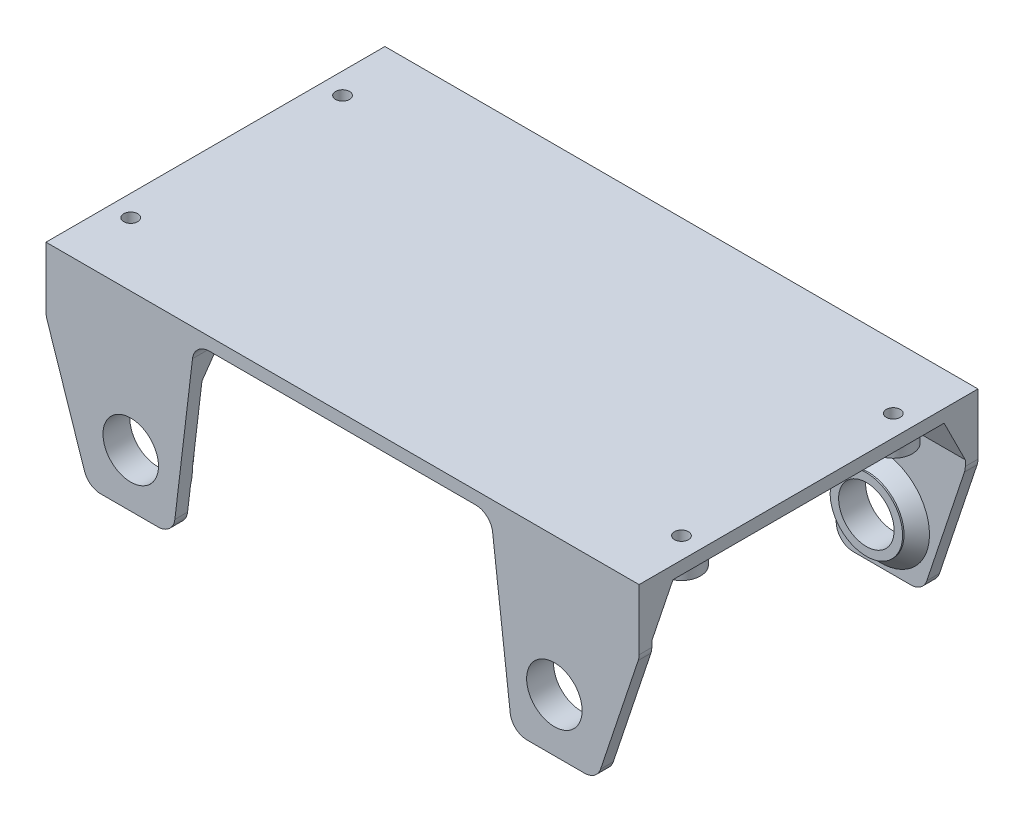
from build123d import *
from OCP.BRepFilletAPI import BRepFilletAPI_MakeChamfer

# Parameters (mm, degrees)
CROQUIS1_W                 = 140
CROQUIS1_H                 = 45
SALIENTE_EXTRUIR1_DEPTH    = 40
CORTAR_EXTRUIR1_DEPTH      = 84.703345214
CORTAR_EXTRUIR1_DEPTH_BACK = 84.703345214
CROQUIS2_W                 = 74
CROQUIS2_H                 = 42
CROQUIS3_R                 = 6.55
CORTAR_EXTRUIR2_DEPTH      = 80
CROQUIS10_R                = 8.55
CROQUIS10_R_2              = 6.55
SALIENTE_EXTRUIR3_DEPTH    = 3.35
CORTAR_EXTRUIR3_REACH      = 92.907
CROQUIS4_R                 = 1.651
CROQUIS5_R                 = 4.5
CROQUIS5_R_2               = 3.5
SALIENTE_EXTRUIR2_DEPTH    = 3
CHAFL_N3_SIZE              = 3
CORTAR_EXTRUIR5_DEPTH      = 84.703345214
CORTAR_EXTRUIR5_DEPTH_BACK = 84.703345214
REDONDEO1_R                = 4
CHAFL_N1_SIZE              = 10
CHAFL_N1_SIZE2             = 5
CHAFL_N2_SIZE              = 5
CHAFL_N2_SIZE2             = 10


with BuildPart() as part:
    # Croquis1 → Saliente-Extruir1 (new, symmetric)
    with BuildSketch(Plane.XY):
        Rectangle(CROQUIS1_W, CROQUIS1_H)
    extrude(amount=SALIENTE_EXTRUIR1_DEPTH, both=True)

    # Croquis2 → Cortar-Extruir1 (cut, two sides: drawn at the far end of the back side and taken through both)
    with BuildSketch(Plane(origin=(0, 0, 0), x_dir=(0, 0, -1), z_dir=(1, 0, 0)).offset(-CORTAR_EXTRUIR1_DEPTH_BACK)):
        with Locations((0, -1.5)):
            Rectangle(CROQUIS2_W, CROQUIS2_H)
    extrude(amount=CORTAR_EXTRUIR1_DEPTH + CORTAR_EXTRUIR1_DEPTH_BACK, mode=Mode.SUBTRACT)

    # Croquis3 → Cortar-Extruir2 (cut)
    with BuildSketch(Plane.XY.offset(40)):
        with Locations((50, -10)):
            Circle(CROQUIS3_R)
        with Locations((-50, -10)):
            Circle(CROQUIS3_R)
    extrude(amount=-CORTAR_EXTRUIR2_DEPTH, mode=Mode.SUBTRACT)

    # Croquis10 → Saliente-Extruir3 (add)
    # profile 1 of 2: a face of its own
    with BuildSketch(Plane(origin=(0, 0, 37), x_dir=(-1, 0, 0), z_dir=(0, 0, -1))):
        with Locations(Location((-50, -10, 0), (0, 0, 270))):
            Circle(CROQUIS10_R)
        with Locations(Location((-50, -10, 0), (0, 0, 180))):
            Circle(CROQUIS10_R_2, mode=Mode.SUBTRACT)
    # profile 2 of 2: a face of its own
    with BuildSketch(Plane(origin=(0, 0, 37), x_dir=(-1, 0, 0), z_dir=(0, 0, -1))):
        with Locations(Location((50, -10, 0), (0, 0, 270))):
            Circle(CROQUIS10_R)
        with Locations(Location((50, -10, 0), (0, 0, 180))):
            Circle(CROQUIS10_R_2, mode=Mode.SUBTRACT)
    saliente_extruir3 = extrude(amount=SALIENTE_EXTRUIR3_DEPTH)

    # Simetría1: Saliente-Extruir3 across plane
    add(saliente_extruir3.mirror(Plane.XY))

    # Croquis4 → Cortar-Extruir3 (cut, up to next)
    with BuildSketch(Plane.XZ.offset(-19.5), mode=Mode.PRIVATE) as cortar_extruir3_sk1:
        with Locations(Location((-65, 25, 0), (0, 0, 270))):
            Circle(CROQUIS4_R)
    cortar_extruir3_tool1 = extrude(cortar_extruir3_sk1.sketch, amount=-CORTAR_EXTRUIR3_REACH, mode=Mode.PRIVATE) & part.part
    # Croquis4 → Cortar-Extruir3 (cut, up to next)
    with BuildSketch(Plane.XZ.offset(-19.5), mode=Mode.PRIVATE) as cortar_extruir3_sk2:
        with Locations(Location((-65, -25, 0), (0, 0, 270))):
            Circle(CROQUIS4_R)
    cortar_extruir3_tool2 = extrude(cortar_extruir3_sk2.sketch, amount=-CORTAR_EXTRUIR3_REACH, mode=Mode.PRIVATE) & part.part
    cortar_extruir3_1 = cortar_extruir3_tool1.solids().sort_by_distance((-65, 19.5, 25))[0]
    add(cortar_extruir3_1, mode=Mode.SUBTRACT)
    cortar_extruir3_2 = cortar_extruir3_tool2.solids().sort_by_distance((-65, 19.5, -25))[0]
    add(cortar_extruir3_2, mode=Mode.SUBTRACT)
    cortar_extruir3 = cortar_extruir3_1 + cortar_extruir3_2  # Cortar-Extruir3 as one shape, for the pattern or mirror that repeats it

    # Croquis5 → Saliente-Extruir2 (add)
    # profile 1 of 2: a face of its own
    with BuildSketch(Plane.XZ.offset(-19.5)):
        with Locations(Location((-65, 25, 0), (0, 0, 90))):
            Circle(CROQUIS5_R)
        with Locations(Location((-65, 25, 0), (0, 0, 270))):
            Circle(CROQUIS5_R_2, mode=Mode.SUBTRACT)
    # profile 2 of 2: a face of its own
    with BuildSketch(Plane.XZ.offset(-19.5)):
        with Locations(Location((-65, -25, 0), (0, 0, 90))):
            Circle(CROQUIS5_R)
        with Locations(Location((-65, -25, 0), (0, 0, 270))):
            Circle(CROQUIS5_R_2, mode=Mode.SUBTRACT)
    saliente_extruir2 = extrude(amount=SALIENTE_EXTRUIR2_DEPTH)

    # Simetría2: Cortar-Extruir3, Saliente-Extruir2 across plane
    add(cortar_extruir3.mirror(Plane(origin=(0, 0, 0), x_dir=(0, 0, 1), z_dir=(1, 0, 0))), mode=Mode.SUBTRACT)
    add(saliente_extruir2.mirror(Plane(origin=(0, 0, 0), x_dir=(0, 0, 1), z_dir=(1, 0, 0))))

    # Chaflán3
    chafl_n3_edges = [part.edges().sort_by_distance(p)[0] for p in [
        (50, -1.45, 37),
        (-50, -1.45, 37),
        (50, -1.45, -37),
        (-50, -1.45, -37),
    ]]
    chamfer(chafl_n3_edges, length=CHAFL_N3_SIZE)

    # Croquis9 → Cortar-Extruir5 (cut, two sides: drawn at the far end of the back side and taken through both)
    with BuildSketch(Plane.XY.offset(-CORTAR_EXTRUIR5_DEPTH_BACK)):
        Polygon((-40, -22.5), (-35, 19.5), (35, 19.5), (40, -22.5), align=None)
        Polygon((-70, 7.5), (-60, -22.5), (-70, -22.5), align=None)
        Polygon((70, 7.5), (60, -22.5), (70, -22.5), align=None)
    extrude(amount=CORTAR_EXTRUIR5_DEPTH + CORTAR_EXTRUIR5_DEPTH_BACK, mode=Mode.SUBTRACT)

    # Redondeo1
    redondeo1_edges = [part.edges().sort_by_distance(p)[0] for p in [
        (40, -22.5, 38.5),
        (40, -22.5, -38.5),
        (-35, 19.5, 38.5),
        (-35, 19.5, -38.5),
        (-40, -22.5, -38.5),
        (-40, -22.5, 38.5),
        (35, 19.5, -38.5),
        (35, 19.5, 38.5),
        (-70, 7.5, 38.5),
        (-70, 7.5, -38.5),
        (-60, -22.5, 38.5),
        (-60, -22.5, -38.5),
        (70, 7.5, 38.5),
        (70, 7.5, -38.5),
        (60, -22.5, 38.5),
        (60, -22.5, -38.5),
    ]]
    fillet(redondeo1_edges, radius=REDONDEO1_R)

    # Chaflán1: one chamfer whose edges measure the first distance from different faces: ONE call of the kernel's chamfer builder (chamfer() names one face for all edges)
    chafl_n1_edges_1 = [part.edges().sort_by_distance(p)[0] for p in [
        (50.723972764, 19.5, -37),
    ]]
    chafl_n1_side_1 = [part.faces().sort_by_distance(p)[0] for p in [
        (53.195449018, 6.150722288, -37),
    ]]
    chafl_n1_edges_2 = [part.edges().sort_by_distance(p)[0] for p in [
        (-50.723972764, 19.5, -37),
    ]]
    chafl_n1_side_2 = [part.faces().sort_by_distance(p)[0] for p in [
        (-53.195449018, 6.150722288, -37),
    ]]
    chafl_n1 = BRepFilletAPI_MakeChamfer(part.part.solid().wrapped)
    for e in chafl_n1_edges_1:
        chafl_n1.Add(CHAFL_N1_SIZE, CHAFL_N1_SIZE2, e.wrapped, chafl_n1_side_1[0].wrapped)  # the first distance lies on this face
    for e in chafl_n1_edges_2:
        chafl_n1.Add(CHAFL_N1_SIZE, CHAFL_N1_SIZE2, e.wrapped, chafl_n1_side_2[0].wrapped)  # the first distance lies on this face
    add(Compound.cast(chafl_n1.Shape()), mode=Mode.REPLACE)

    # Chaflán2
    chafl_n2_edges = [part.edges().sort_by_distance(p)[0] for p in [
        (50.723972764, 19.5, 37),
        (-50.723972764, 19.5, 37),
    ]]
    chafl_n2_side = [part.faces().sort_by_distance(p)[0] for p in [
        (0, 19.5, 1.317218046),
    ]]
    chamfer(chafl_n2_edges, length=CHAFL_N2_SIZE, length2=CHAFL_N2_SIZE2, reference=chafl_n2_side[0])


solid = part.part
